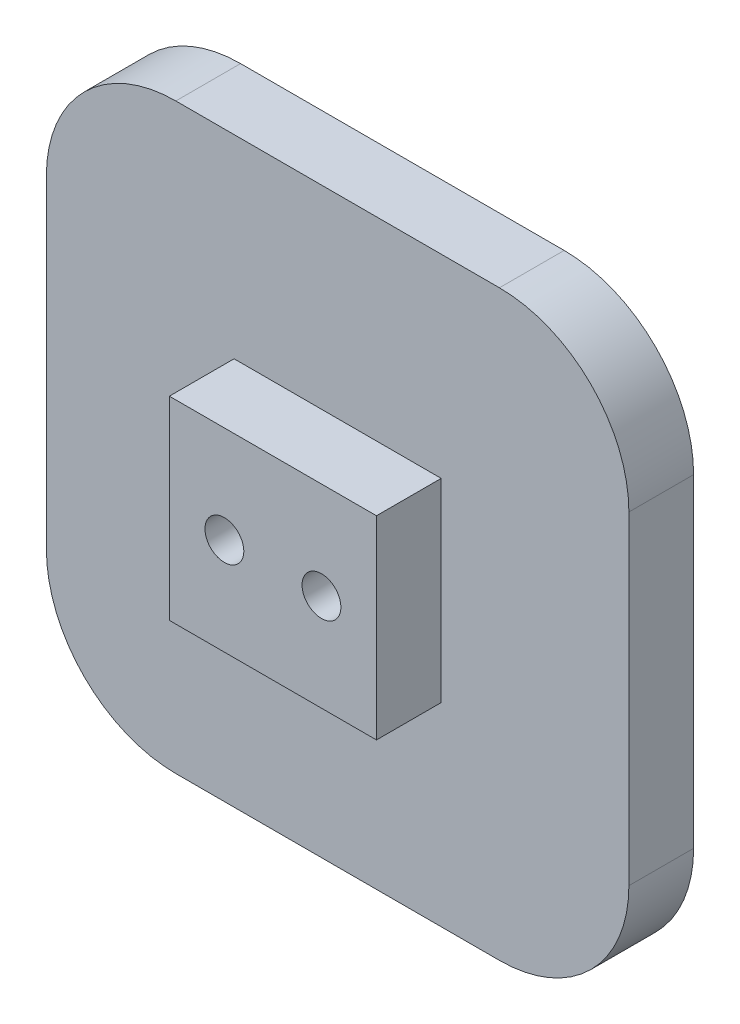
from build123d import *

# Parameters (mm, degrees)
Y_KSEKLIK_EKSTR_ZYON1_DEPTH = 20
CUT_EXTRUDE1_DEPTH          = 44
CUT_EXTRUDE1_DEPTH_BACK     = 10
SKETCH1_R                   = 2.5
SKETCH2_W                   = 32
SKETCH2_H                   = 30
CUT_EXTRUDE3_DEPTH          = 27
SKETCH3_W                   = 32
SKETCH3_H                   = 30
BOSS_EXTRUDE1_DEPTH         = 16
CUT_EXTRUDE4_DEPTH          = 4
SKETCH5_W                   = 33.515954684
SKETCH5_H                   = 18.308274805
BOSS_EXTRUDE2_DEPTH         = 10
CUT_EXTRUDE5_DEPTH          = 53
CUT_EXTRUDE5_DEPTH_BACK     = 25
SKETCH6_R                   = 2.5
SKETCH7_W                   = 36.495036791
SKETCH7_H                   = 91.485439351
SKETCH7_W_2                 = 38.306268879
CUT_EXTRUDE7_DEPTH          = 30
SKETCH8_W                   = 29
SKETCH8_H                   = 90
BOSS_EXTRUDE3_DEPTH         = 10
CUT_EXTRUDE8_DEPTH          = 10
SKETCH10_W                  = 32
SKETCH10_H                  = 30
CUT_EXTRUDE9_DEPTH          = 28
SKETCH11_W                  = 32
SKETCH11_H                  = 30
BOSS_EXTRUDE4_DEPTH         = 10
SKETCH12_R                  = 3
CUT_EXTRUDE10_DEPTH         = 22
SKETCH13_R                  = 6
CUT_EXTRUDE11_DEPTH         = 5


with BuildPart() as part:
    # Çizim1 → Yükseklik-Ekstrüzyon1 (new body)
    with BuildSketch(Plane.XY):
        with BuildLine():
            Line((-41.541366964, -1.110887656), (-41.541366964, 48.889112344))
            ThreePointArc((-41.541366964, 48.889112344), (-35.683502588, 63.031247968), (-21.541366964, 68.889112344))
            Line((-21.541366964, 68.889112344), (28.458633036, 68.889112344))
            ThreePointArc((28.458633036, 68.889112344), (42.600768659, 63.031247968), (48.458633036, 48.889112344))
            Line((48.458633036, 48.889112344), (48.458633036, -1.110887656))
            ThreePointArc((48.458633036, -1.110887656), (42.600768659, -15.25302328), (28.458633036, -21.110887656))
            Line((28.458633036, -21.110887656), (-21.541366964, -21.110887656))
            ThreePointArc((-21.541366964, -21.110887656), (-35.683502588, -15.25302328), (-41.541366964, -1.110887656))
        make_face()
    extrude(amount=Y_KSEKLIK_EKSTR_ZYON1_DEPTH)

    # Sketch1 → Cut-Extrude1 (cut, two sides: drawn at the far end of the back side and taken through both)
    with BuildSketch(Plane.XY.offset(-CUT_EXTRUDE1_DEPTH_BACK)):
        with Locations(Location((-4.041366964, 23.889112344, 0), (0, 0, 180))):
            Circle(SKETCH1_R)
        with Locations(Location((10.958633036, 23.889112344, 0), (0, 0, 180))):
            Circle(SKETCH1_R)
    extrude(amount=CUT_EXTRUDE1_DEPTH + CUT_EXTRUDE1_DEPTH_BACK, mode=Mode.SUBTRACT)

    # Sketch2 → Cut-Extrude3 (cut)
    with BuildSketch(Plane.XY):
        with Locations((3.458633036, 53.889112344)):
            Rectangle(SKETCH2_W, SKETCH2_H)
    extrude(amount=CUT_EXTRUDE3_DEPTH, mode=Mode.SUBTRACT)

    # Sketch3 → Boss-Extrude1 (add)
    with BuildSketch(Plane.XY):
        with Locations((3.458633036, 53.889112344)):
            Rectangle(SKETCH3_W, SKETCH3_H)
    extrude(amount=BOSS_EXTRUDE1_DEPTH)

    # Sketch4 → Cut-Extrude4 (cut)
    with BuildSketch(Plane.XY):
        Polygon((15.692905243, 23.889112344), (13.325769139, 27.989112344), (8.591496932, 27.989112344), (6.224360828, 23.889112344), (8.591496932, 19.789112344), (13.325769139, 19.789112344), align=None)
        Polygon((0.692905243, 23.889112344), (-1.674230861, 27.989112344), (-6.408503068, 27.989112344), (-8.775639172, 23.889112344), (-6.408503068, 19.789112344), (-1.674230861, 19.789112344), align=None)
    extrude(amount=CUT_EXTRUDE4_DEPTH, mode=Mode.SUBTRACT)

    # Sketch5 → Boss-Extrude2 (add)
    with BuildSketch(Plane.XY):
        with Locations((2.203630327, 23.667641278)):
            Rectangle(SKETCH5_W, SKETCH5_H)
    extrude(amount=BOSS_EXTRUDE2_DEPTH)

    # Sketch6 → Cut-Extrude5 (cut, two sides: drawn at the far end of the back side and taken through both)
    with BuildSketch(Plane.XY.offset(-CUT_EXTRUDE5_DEPTH_BACK)):
        with Locations(Location((-4.041366964, 23.889112344, 0), (0, 0, 180))):
            Circle(SKETCH6_R)
        with Locations(Location((10.958633036, 23.889112344, 0), (0, 0, 180))):
            Circle(SKETCH6_R)
    extrude(amount=CUT_EXTRUDE5_DEPTH + CUT_EXTRUDE5_DEPTH_BACK, mode=Mode.SUBTRACT)

    # Sketch7 → Cut-Extrude7 (cut)
    with BuildSketch(Plane.XY):
        with Locations((-30.78888536, 23.146392668)):
            Rectangle(SKETCH7_W, SKETCH7_H)
        with Locations((38.611767476, 23.146392668)):
            Rectangle(SKETCH7_W_2, SKETCH7_H)
    extrude(amount=CUT_EXTRUDE7_DEPTH, mode=Mode.SUBTRACT)

    # Sketch8 → Boss-Extrude3 (add)
    with BuildSketch(Plane.XY):
        with Locations((-27.041366964, 23.889112344)):
            Rectangle(SKETCH8_W, SKETCH8_H)
        with Locations((33.958633036, 23.889112344)):
            Rectangle(SKETCH8_W, SKETCH8_H)
    extrude(amount=BOSS_EXTRUDE3_DEPTH)

    # Sketch9 → Cut-Extrude8 (cut)
    with BuildSketch(Plane.XY):
        with BuildLine():
            Line((-41.541366964, 68.889112344), (-21.541366964, 68.889112344))
            ThreePointArc((-21.541366964, 68.889112344), (-35.683502588, 63.031247968), (-41.541366964, 48.889112344))
            Line((-41.541366964, 48.889112344), (-41.541366964, 68.889112344))
        make_face()
        with BuildLine():
            Line((48.458633036, 68.889112344), (48.458633036, 48.889112344))
            ThreePointArc((48.458633036, 48.889112344), (42.600768659, 63.031247968), (28.458633036, 68.889112344))
            Line((28.458633036, 68.889112344), (48.458633036, 68.889112344))
        make_face()
        with BuildLine():
            Line((48.458633036, -21.110887656), (28.458633036, -21.110887656))
            ThreePointArc((28.458633036, -21.110887656), (42.600768659, -15.25302328), (48.458633036, -1.110887656))
            Line((48.458633036, -1.110887656), (48.458633036, -21.110887656))
        make_face()
        with BuildLine():
            Line((-41.541366964, -21.110887656), (-41.541366964, -1.110887656))
            ThreePointArc((-41.541366964, -1.110887656), (-35.683502588, -15.25302328), (-21.541366964, -21.110887656))
            Line((-21.541366964, -21.110887656), (-41.541366964, -21.110887656))
        make_face()
    extrude(amount=CUT_EXTRUDE8_DEPTH, mode=Mode.SUBTRACT)

    # Sketch10 → Cut-Extrude9 (cut)
    with BuildSketch(Plane.XY):
        with Locations((3.458633036, 53.889112344)):
            Rectangle(SKETCH10_W, SKETCH10_H)
        with Locations((3.458633036, -6.110887656)):
            Rectangle(SKETCH10_W, SKETCH10_H)
    extrude(amount=CUT_EXTRUDE9_DEPTH, mode=Mode.SUBTRACT)

    # Sketch11 → Boss-Extrude4 (add)
    with BuildSketch(Plane.XY):
        with Locations((3.458633036, 53.889112344)):
            Rectangle(SKETCH11_W, SKETCH11_H)
        with Locations((3.458633036, -6.110887656)):
            Rectangle(SKETCH11_W, SKETCH11_H)
    extrude(amount=BOSS_EXTRUDE4_DEPTH)

    # Sketch12 → Cut-Extrude10 (cut)
    with BuildSketch(Plane.XY):
        with Locations(Location((-4.041366964, 23.889112344, 0), (0, 0, 180))):
            Circle(SKETCH12_R)
        with Locations(Location((10.958633036, 23.889112344, 0), (0, 0, 180))):
            Circle(SKETCH12_R)
    extrude(amount=CUT_EXTRUDE10_DEPTH, mode=Mode.SUBTRACT)

    # Sketch13 → Cut-Extrude11 (cut)
    with BuildSketch(Plane.XY):
        with Locations((10.958633036, 23.889112344)):
            Circle(SKETCH13_R)
        with Locations((-4.041366964, 23.889112344)):
            Circle(SKETCH13_R)
    extrude(amount=CUT_EXTRUDE11_DEPTH, mode=Mode.SUBTRACT)


solid = part.part
